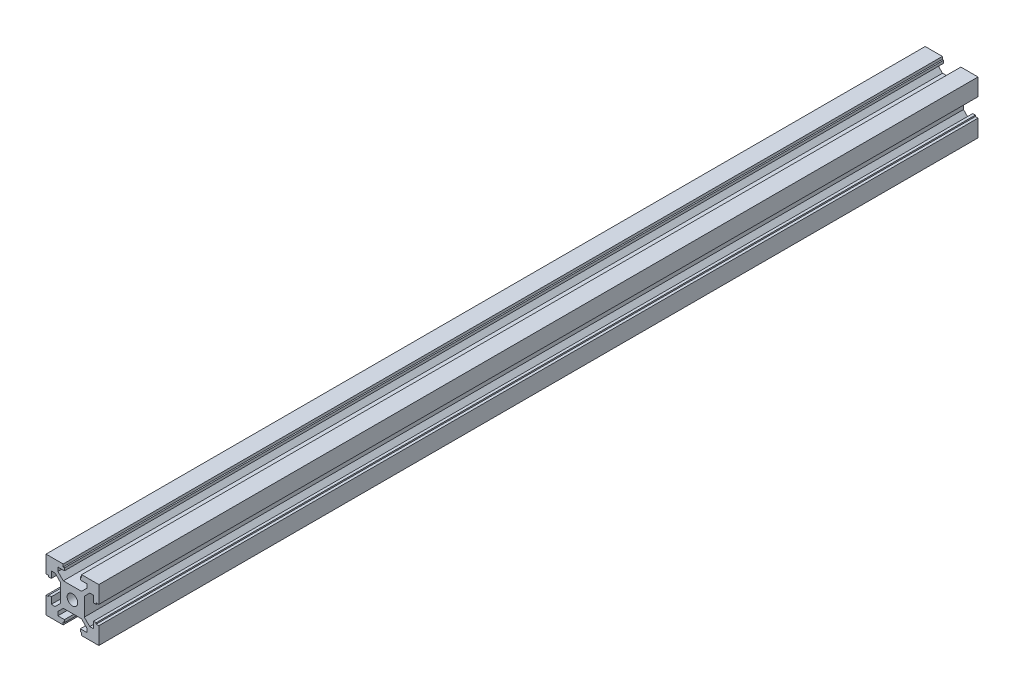
from build123d import *

# Parameters (mm, degrees)
SKETCH1_R           = 2
BOSS_EXTRUDE1_DEPTH = 333


with BuildPart() as part:
    # Sketch1 → Boss-Extrude1 (new body)
    with BuildSketch(Plane.XY):
        Polygon((-10, -10), (-3.5, -10), (-3.5, -9), (-3, -9), (-3, -8), (-5.5, -8), (-5.5, -6.560660172), (-3.44, -4.500660172), (3.44, -4.500660172), (5.5, -6.560660172), (5.5, -8), (3, -8), (3, -9), (3.5, -9), (3.5, -10), (10, -10), (10, -3.5), (9, -3.5), (9, -3), (8, -3), (8, -5.5), (6.560660172, -5.5), (4.500660172, -3.44), (4.500660172, 3.44), (6.560660172, 5.5), (8, 5.5), (8, 3), (9, 3), (9, 3.5), (10, 3.5), (10, 10), (3.5, 10), (3.5, 9), (3, 9), (3, 8), (5.5, 8), (5.5, 6.560660172), (3.44, 4.500660172), (-3.44, 4.500660172), (-5.5, 6.560660172), (-5.5, 8), (-3, 8), (-3, 9), (-3.5, 9), (-3.5, 10), (-10, 10), (-10, 3.5), (-9, 3.5), (-9, 3), (-8, 3), (-8, 5.5), (-6.560660172, 5.5), (-4.500660172, 3.44), (-4.500660172, -3.44), (-6.560660172, -5.5), (-8, -5.5), (-8, -3), (-9, -3), (-9, -3.5), (-10, -3.5), align=None)
        Circle(SKETCH1_R, mode=Mode.SUBTRACT)
    extrude(amount=BOSS_EXTRUDE1_DEPTH)


solid = part.part
